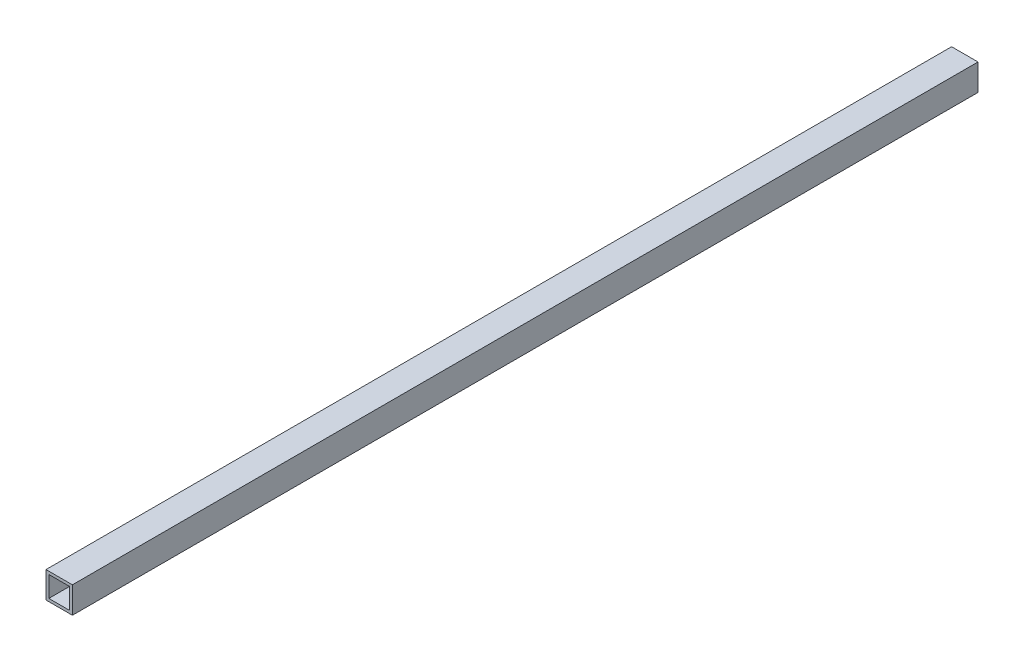
from build123d import *

# Parameters (mm, degrees)
SKETCH_1_W      = 14
SKETCH_1_H      = 14
SKETCH_1_W_2    = 11
SKETCH_1_H_2    = 11
EXTRUDE_1_DEPTH = 480


with BuildPart() as part:
    # 草图1 → 拉伸-薄壁1 (new body)
    with BuildSketch(Plane.XY):
        Rectangle(SKETCH_1_W, SKETCH_1_H)
        Rectangle(SKETCH_1_W_2, SKETCH_1_H_2, mode=Mode.SUBTRACT)
    extrude(amount=EXTRUDE_1_DEPTH)


solid = part.part
